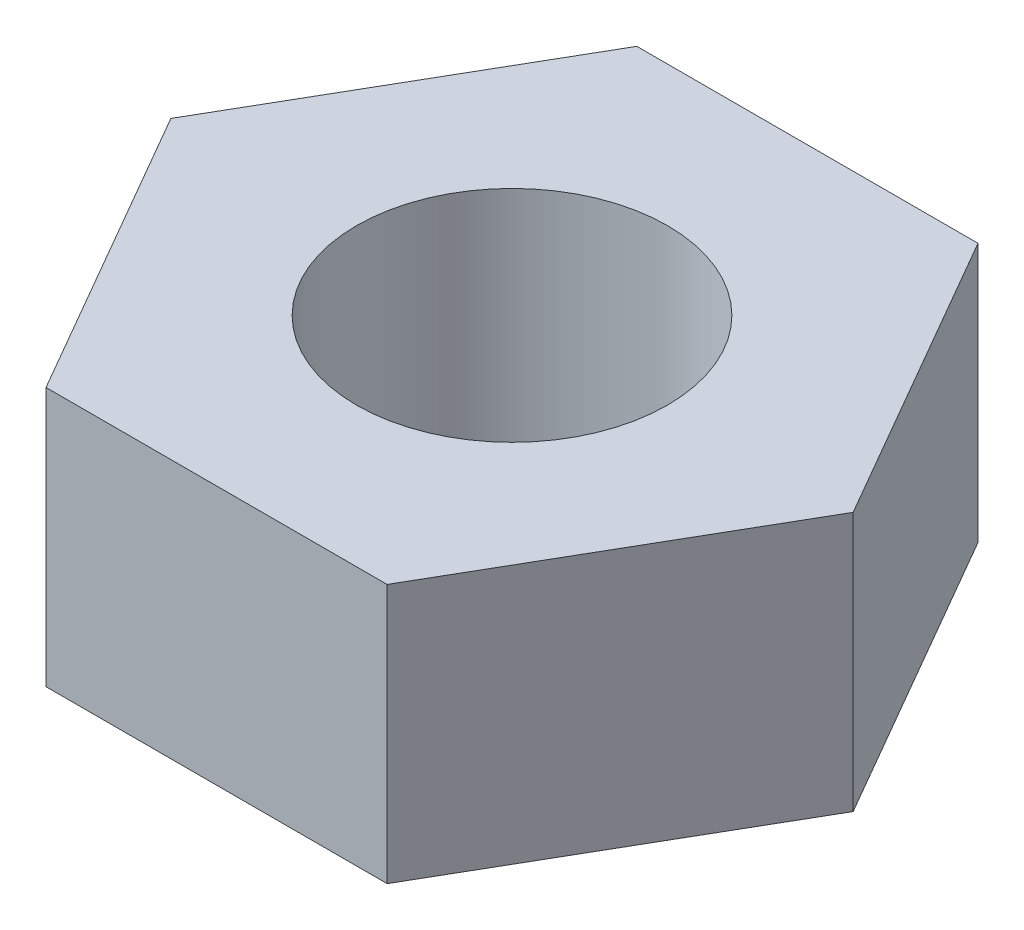
from build123d import *

# Parameters (mm, degrees)
SKETCH1_R       = 1.5
THICKNESS_DEPTH = 2.5


with BuildPart() as part:
    # Sketch1 → Thickness (new body)
    with BuildSketch(Plane(origin=(0, 0, 0), x_dir=(1, 0, 0), z_dir=(0, 1, 0))):
        Polygon((3.290896534, 0), (1.645448267, 2.85), (-1.645448267, 2.85), (-3.290896534, 0), (-1.645448267, -2.85), (1.645448267, -2.85), align=None)
        with Locations(Location((0, 0, 0), (0, 0, 270))):
            Circle(SKETCH1_R, mode=Mode.SUBTRACT)
    extrude(amount=THICKNESS_DEPTH)


solid = part.part
